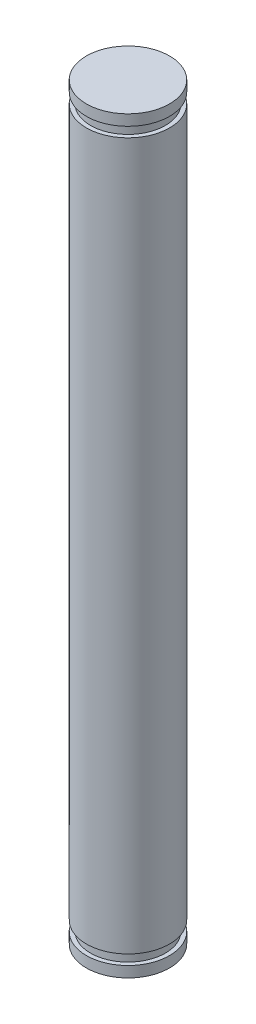
from build123d import *


with BuildPart() as part:
    # 草图1 → 旋转1 (revolve)
    with BuildSketch(Plane.XY):
        Polygon((0, 0), (-5, 0), (-5, 1.3), (-4.5, 1.3), (-4.5, 2.5), (-5, 2.5), (-5, 87.5), (-4.5, 87.5), (-4.5, 88.7), (-5, 88.7), (-5, 90), (0, 90), align=None)
    revolve(axis=Axis((0, 90, 0), (0, -1, 0)))


solid = part.part
